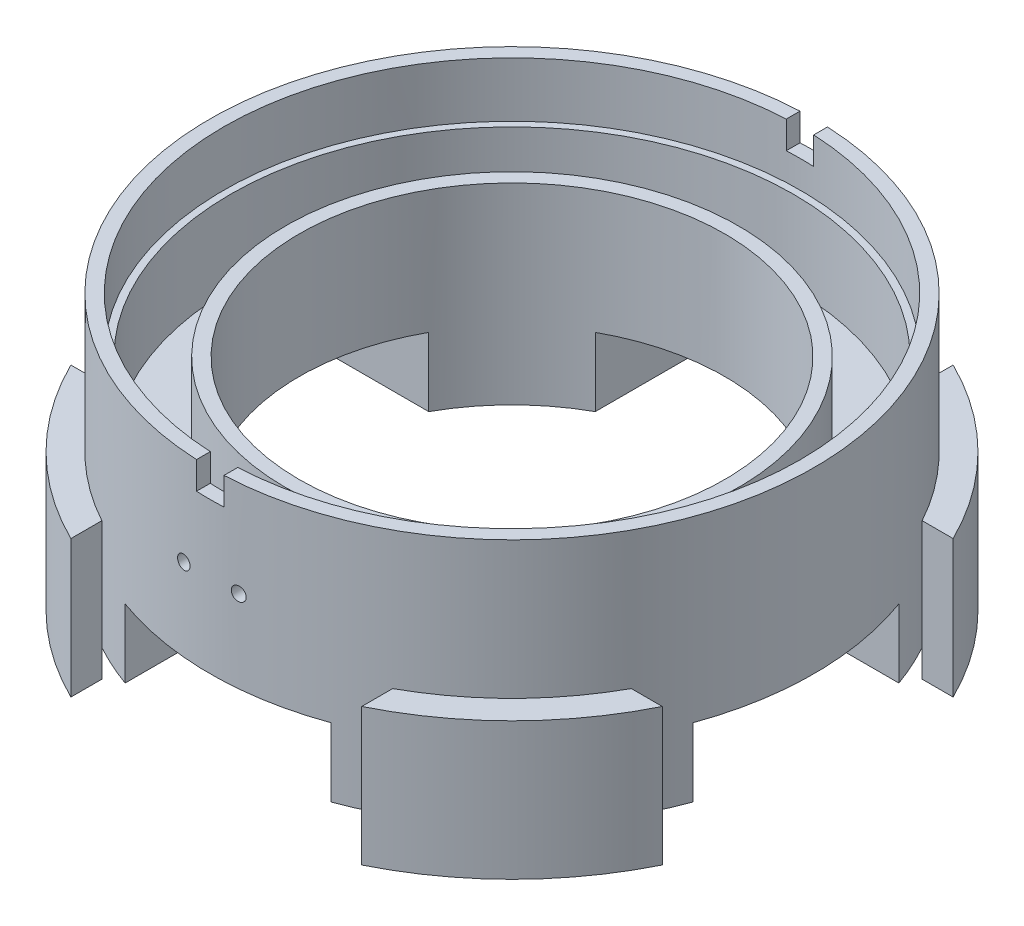
from build123d import *

# Parameters (mm, degrees)
EXTRUDE_1_DEPTH          = 2
EXTRUDE_1_2_DEPTH        = 2
EXTRUDE_1_3_DEPTH        = 2
EXTRUDE_1_4_DEPTH        = 2
EXTRUDE_2_DEPTH          = 8
SKETCH_5_R               = 22
SKETCH_5_R_2             = 20.5
EXTRUDE_3_DEPTH          = 8
SKETCH_6_R               = 16.5
SKETCH_6_R_2             = 15.5
EXTRUDE_4_DEPTH          = 7
CUT_EXTRUDE_START        = -10
SKETCH_7_R               = 15.5
CUT_EXTRUDE_1_DEPTH      = 10
SKETCH_8_W               = 15
SKETCH_8_H               = 5
CUT_EXTRUDE_2_DEPTH      = 36.944401511
PATTERN_CIRCULAR_1_COUNT = 2
PATTERN_CIRCULAR_1_ANGLE = 90
EXTRUDE_5_DEPTH          = 2
CUT_EXTRUDE_START_2      = 30
SKETCH_10_R              = 0.5
CUT_EXTRUDE_3_DEPTH      = 10
CUT_EXTRUDE_START_3      = -2
SKETCH_16_R              = 21
CUT_EXTRUDE_5_DEPTH      = 2


with BuildPart() as part:
    # 草图1 → 凸台-拉伸1 (new body)
    with BuildSketch(Plane(origin=(0, 0, 0), x_dir=(1, 0, 0), z_dir=(0, 1, 0))):
        with BuildLine():
            Line((-10.591663047, 21.536403458), (-10.591663047, 19.282548429))
            ThreePointArc((-10.591663047, 19.282548429), (-15.556349186, 15.556349186), (-19.282548429, 10.591663047))
            Line((-19.282548429, 10.591663047), (-21.536403458, 10.591663047))
            ThreePointArc((-21.536403458, 10.591663047), (-16.970562748, 16.970562748), (-10.591663047, 21.536403458))
        make_face()
    extrude(amount=EXTRUDE_1_DEPTH)



with BuildPart() as body_2:
    # 草图1 → Extrude 1 2 (new body)
    with BuildSketch(Plane(origin=(0, 0, 0), x_dir=(1, 0, 0), z_dir=(0, 1, 0))):
        with BuildLine():
            Line((10.591663047, 21.536403458), (10.591663047, 19.282548429))
            ThreePointArc((10.591663047, 19.282548429), (15.556349186, 15.556349186), (19.282548429, 10.591663047))
            Line((19.282548429, 10.591663047), (21.536403458, 10.591663047))
            ThreePointArc((21.536403458, 10.591663047), (16.970562748, 16.970562748), (10.591663047, 21.536403458))
        make_face()
    extrude(amount=EXTRUDE_1_2_DEPTH)


with BuildPart() as body_3:
    # 草图1 → Extrude 1 3 (new body)
    with BuildSketch(Plane(origin=(0, 0, 0), x_dir=(1, 0, 0), z_dir=(0, 1, 0))):
        with BuildLine():
            Line((-21.536403458, -10.591663047), (-19.282548429, -10.591663047))
            ThreePointArc((-19.282548429, -10.591663047), (-15.556349186, -15.556349186), (-10.591663047, -19.282548429))
            Line((-10.591663047, -19.282548429), (-10.591663047, -21.536403458))
            ThreePointArc((-10.591663047, -21.536403458), (-16.970562748, -16.970562748), (-21.536403458, -10.591663047))
        make_face()
    extrude(amount=EXTRUDE_1_3_DEPTH)


with BuildPart() as body_4:
    # 草图1 → Extrude 1 4 (new body)
    with BuildSketch(Plane(origin=(0, 0, 0), x_dir=(1, 0, 0), z_dir=(0, 1, 0))):
        with BuildLine():
            Line((21.536403458, -10.591663047), (19.282548429, -10.591663047))
            ThreePointArc((19.282548429, -10.591663047), (15.556349186, -15.556349186), (10.591663047, -19.282548429))
            Line((10.591663047, -19.282548429), (10.591663047, -21.536403458))
            ThreePointArc((10.591663047, -21.536403458), (16.970562748, -16.970562748), (21.536403458, -10.591663047))
        make_face()
    extrude(amount=EXTRUDE_1_4_DEPTH)


with BuildPart() as part_1:
    add(part.part)

    add(body_2.part)  # 凸台-拉伸2 merges body 2

    add(body_3.part)  # 凸台-拉伸2 merges body 3

    add(body_4.part)  # 凸台-拉伸2 merges body 4
    # 草图4 → 凸台-拉伸2 (add)
    with BuildSketch(Plane(origin=(0, 2, 0), x_dir=(1, 0, 0), z_dir=(0, 1, 0))):
        with BuildLine():
            Line((-10.591663047, 21.536403458), (-10.591663047, 19.282548429))
            ThreePointArc((-10.591663047, 19.282548429), (0, 22), (10.591663047, 19.282548429))
            Line((10.591663047, 19.282548429), (10.591663047, 21.536403458))
            ThreePointArc((10.591663047, 21.536403458), (16.970562748, 16.970562748), (21.536403458, 10.591663047))
            Line((21.536403458, 10.591663047), (19.282548429, 10.591663047))
            ThreePointArc((19.282548429, 10.591663047), (22, 0), (19.282548429, -10.591663047))
            Line((19.282548429, -10.591663047), (21.536403458, -10.591663047))
            ThreePointArc((21.536403458, -10.591663047), (16.970562748, -16.970562748), (10.591663047, -21.536403458))
            Line((10.591663047, -21.536403458), (10.591663047, -19.282548429))
            ThreePointArc((10.591663047, -19.282548429), (0, -22), (-10.591663047, -19.282548429))
            Line((-10.591663047, -19.282548429), (-10.591663047, -21.536403458))
            ThreePointArc((-10.591663047, -21.536403458), (-16.970562748, -16.970562748), (-21.536403458, -10.591663047))
            Line((-21.536403458, -10.591663047), (-19.282548429, -10.591663047))
            ThreePointArc((-19.282548429, -10.591663047), (-22, 0), (-19.282548429, 10.591663047))
            Line((-19.282548429, 10.591663047), (-21.536403458, 10.591663047))
            ThreePointArc((-21.536403458, 10.591663047), (-16.970562748, 16.970562748), (-10.591663047, 21.536403458))
        make_face()
    extrude(amount=EXTRUDE_2_DEPTH)

    # 草图5 → 凸台-拉伸3 (add)
    with BuildSketch(Plane(origin=(0, 10, 0), x_dir=(1, 0, 0), z_dir=(0, 1, 0))):
        with Locations(Location((0, 0, 0), (0, 0, 61.22055739))):
            Circle(SKETCH_5_R)
        with Locations(Location((0, 0, 0), (0, 0, 270))):
            Circle(SKETCH_5_R_2, mode=Mode.SUBTRACT)
    extrude(amount=EXTRUDE_3_DEPTH)

    # 草图6 → 凸台-拉伸4 (add)
    with BuildSketch(Plane(origin=(0, 10, 0), x_dir=(1, 0, 0), z_dir=(0, 1, 0))):
        with Locations(Location((0, 0, 0), (0, 0, 270))):
            Circle(SKETCH_6_R)
        with Locations(Location((0, 0, 0), (0, 0, 270))):
            Circle(SKETCH_6_R_2, mode=Mode.SUBTRACT)
    extrude(amount=EXTRUDE_4_DEPTH)

    # 草图7 → 切除-拉伸1 (cut)
    with BuildSketch(Plane(origin=(0, 10, 0), x_dir=(1, 0, 0), z_dir=(0, 1, 0)).offset(CUT_EXTRUDE_START)):
        with Locations(Location((0, 0, 0), (0, 0, 270))):
            Circle(SKETCH_7_R)
    extrude(amount=CUT_EXTRUDE_1_DEPTH, mode=Mode.SUBTRACT)

    # 草图8 → 切除-拉伸2 (cut, symmetric)
    with BuildSketch(Plane.XY):
        with Locations((0, 4.5)):
            Rectangle(SKETCH_8_W, SKETCH_8_H)
    cut_extrude_2 = extrude(amount=CUT_EXTRUDE_2_DEPTH, both=True, mode=Mode.SUBTRACT)

    # 阵列(圆周)1: 切除-拉伸2 ×2 about axis
    pattern_circular_1_axis = Axis((0, 10, 0), (0, -1, 0))
    for i in range(1, PATTERN_CIRCULAR_1_COUNT):
        add(cut_extrude_2.rotate(pattern_circular_1_axis, i * PATTERN_CIRCULAR_1_ANGLE / (PATTERN_CIRCULAR_1_COUNT - 1)), mode=Mode.SUBTRACT)

    # 草图9 → 凸台-拉伸5 (add)
    with BuildSketch(Plane(origin=(0, 18, 0), x_dir=(1, 0, 0), z_dir=(0, 1, 0))):
        with BuildLine():
            Line((1, -20.976176963), (1, -21.977260976))
            ThreePointArc((1, -21.977260976), (22, 0), (1, 21.977260976))
            Line((1, 21.977260976), (1, 20.976176963))
            ThreePointArc((1, 20.976176963), (21, 0), (1, -20.976176963))
        make_face()
        with BuildLine():
            Line((-1, 20.976176963), (-1, 21.977260976))
            ThreePointArc((-1, 21.977260976), (-22, 0), (-1, -21.977260976))
            Line((-1, -21.977260976), (-1, -20.976176963))
            ThreePointArc((-1, -20.976176963), (-21, 0), (-1, 20.976176963))
        make_face()
    extrude(amount=EXTRUDE_5_DEPTH)

    # 草图10 → 切除-拉伸3 (cut)
    with BuildSketch(Plane.XY.offset(CUT_EXTRUDE_START_2)):
        with Locations((-2, 13)):
            Circle(SKETCH_10_R)
        with Locations((2, 13)):
            Circle(SKETCH_10_R)
    extrude(amount=-CUT_EXTRUDE_3_DEPTH, mode=Mode.SUBTRACT)

    # 草图16 → 切除-拉伸5 (cut)
    with BuildSketch(Plane(origin=(0, 18, 0), x_dir=(1, 0, 0), z_dir=(0, 1, 0)).offset(CUT_EXTRUDE_START_3)):
        with Locations(Location((0, 0, 0), (0, 0, 92.729402637))):
            Circle(SKETCH_16_R)
    extrude(amount=CUT_EXTRUDE_5_DEPTH, mode=Mode.SUBTRACT)


solid = part_1.part
